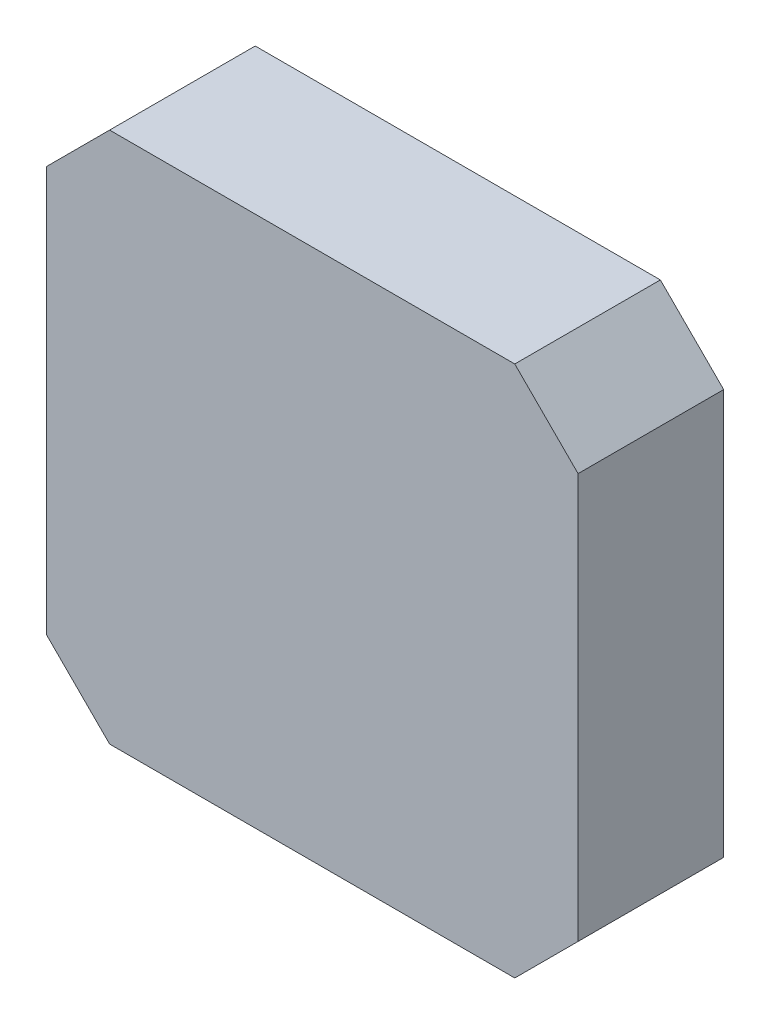
from build123d import *

# Parameters (mm, degrees)
SKETCH1_W           = 42
SKETCH1_H           = 42
BOSS_EXTRUDE1_DEPTH = 11.5
CHAMFER1_SIZE       = 5


with BuildPart() as part:
    # Sketch1 → Boss-Extrude1 (new body)
    with BuildSketch(Plane.XY):
        Rectangle(SKETCH1_W, SKETCH1_H)
    extrude(amount=BOSS_EXTRUDE1_DEPTH)

    # Chamfer1
    chamfer1_edges = [part.edges().sort_by_distance(p)[0] for p in [
        (21, -21, 5.75),
        (-21, -21, 5.75),
        (-21, 21, 5.75),
        (21, 21, 5.75),
    ]]
    chamfer(chamfer1_edges, length=CHAMFER1_SIZE)


solid = part.part
